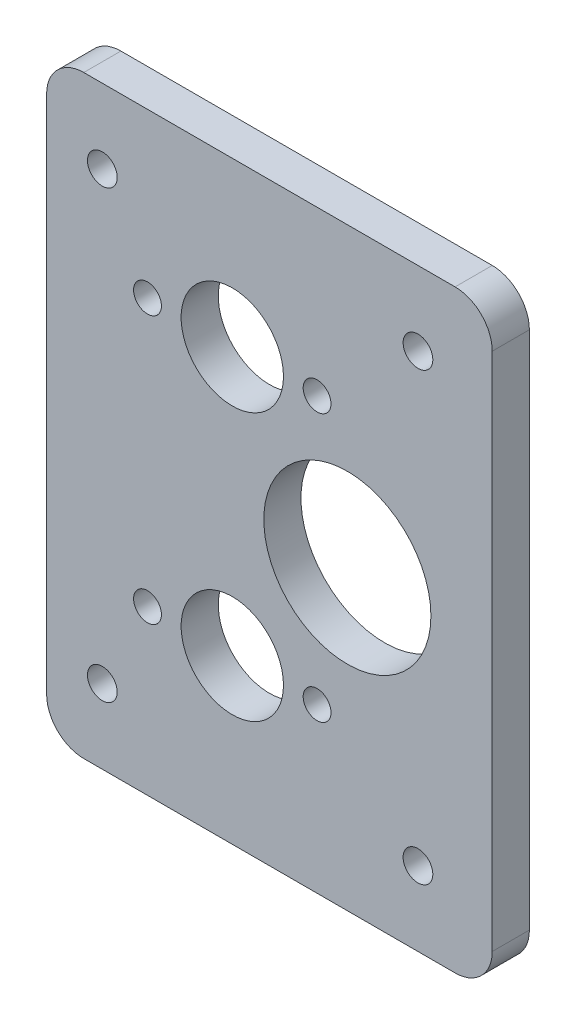
from build123d import *

# Parameters (mm, degrees)
SKETCH1_R           = 2.38125
SKETCH1_R_2         = 14.2875
SKETCH1_R_3         = 8.75
BOSS_EXTRUDE1_DEPTH = 6.35
SKETCH2_R           = 2.54
CUT_EXTRUDE1_DEPTH  = 6.35


with BuildPart() as part:
    # Sketch1 → Boss-Extrude1 (new body)
    with BuildSketch(Plane.XY):
        with BuildLine():
            Line((-25.4, 27.94), (38.1, 27.94))
            ThreePointArc((38.1, 27.94), (42.590128061, 26.080128061), (44.45, 21.59))
            Line((44.45, 21.59), (44.45, -67.31))
            ThreePointArc((44.45, -67.31), (42.590128061, -71.800128061), (38.1, -73.66))
            Line((38.1, -73.66), (-25.4, -73.66))
            ThreePointArc((-25.4, -73.66), (-29.890128061, -71.800128061), (-31.75, -67.31))
            Line((-31.75, -67.31), (-31.75, 21.59))
            ThreePointArc((-31.75, 21.59), (-29.890128061, 26.080128061), (-25.4, 27.94))
        make_face()
        with Locations((14.5, 0)):
            Circle(SKETCH1_R, mode=Mode.SUBTRACT)
        with Locations((-14.5, 0)):
            Circle(SKETCH1_R, mode=Mode.SUBTRACT)
        with Locations((14.5, -45.72)):
            Circle(SKETCH1_R, mode=Mode.SUBTRACT)
        with Locations((-14.5, -45.72)):
            Circle(SKETCH1_R, mode=Mode.SUBTRACT)
        with Locations((19.677317049, -22.86)):
            Circle(SKETCH1_R_2, mode=Mode.SUBTRACT)
        with Locations((0, -45.72)):
            Circle(SKETCH1_R_3, mode=Mode.SUBTRACT)
        Circle(SKETCH1_R_3, mode=Mode.SUBTRACT)
    extrude(amount=BOSS_EXTRUDE1_DEPTH)

    # Sketch2 → Cut-Extrude1 (cut)
    with BuildSketch(Plane.XY.offset(6.35)):
        with Locations((-22.225, 15.24)):
            Circle(SKETCH2_R)
        with Locations((31.75, 15.24)):
            Circle(SKETCH2_R)
        with Locations((31.75, -60.96)):
            Circle(SKETCH2_R)
        with Locations((-22.225, -60.96)):
            Circle(SKETCH2_R)
    extrude(amount=-CUT_EXTRUDE1_DEPTH, mode=Mode.SUBTRACT)


solid = part.part
